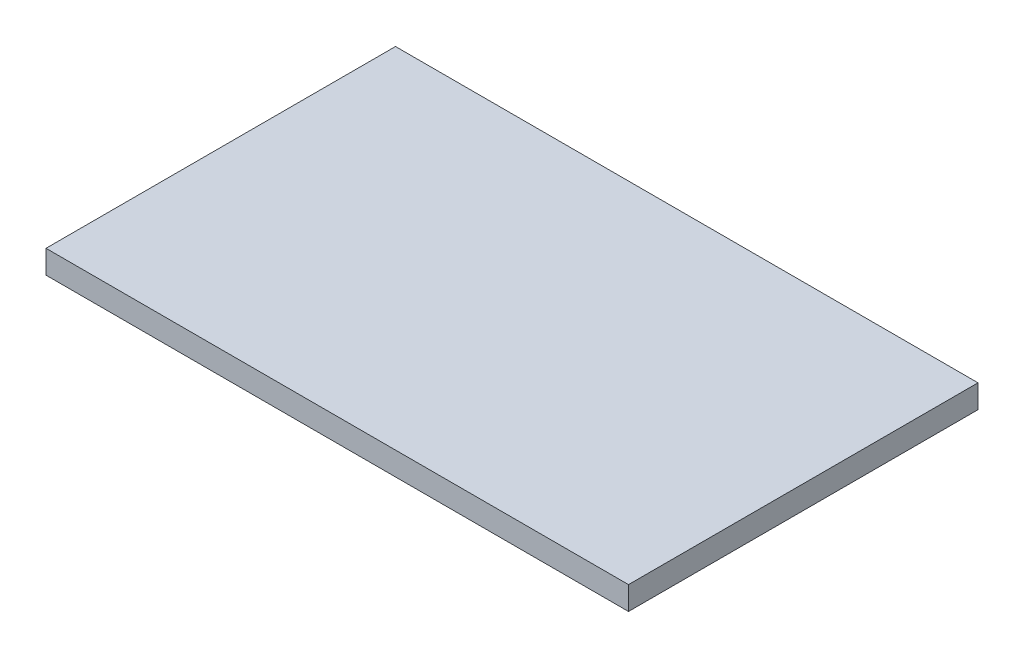
from build123d import *

# Parameters (mm, degrees)
SKETCH1_W           = 200
SKETCH1_H           = 120
BOSS_EXTRUDE1_DEPTH = 4


with BuildPart() as part:
    # Sketch1 → Boss-Extrude1 (new, symmetric)
    with BuildSketch(Plane(origin=(0, 0, 0), x_dir=(1, 0, 0), z_dir=(0, 1, 0))):
        Rectangle(SKETCH1_W, SKETCH1_H)
    extrude(amount=BOSS_EXTRUDE1_DEPTH, both=True)


solid = part.part
